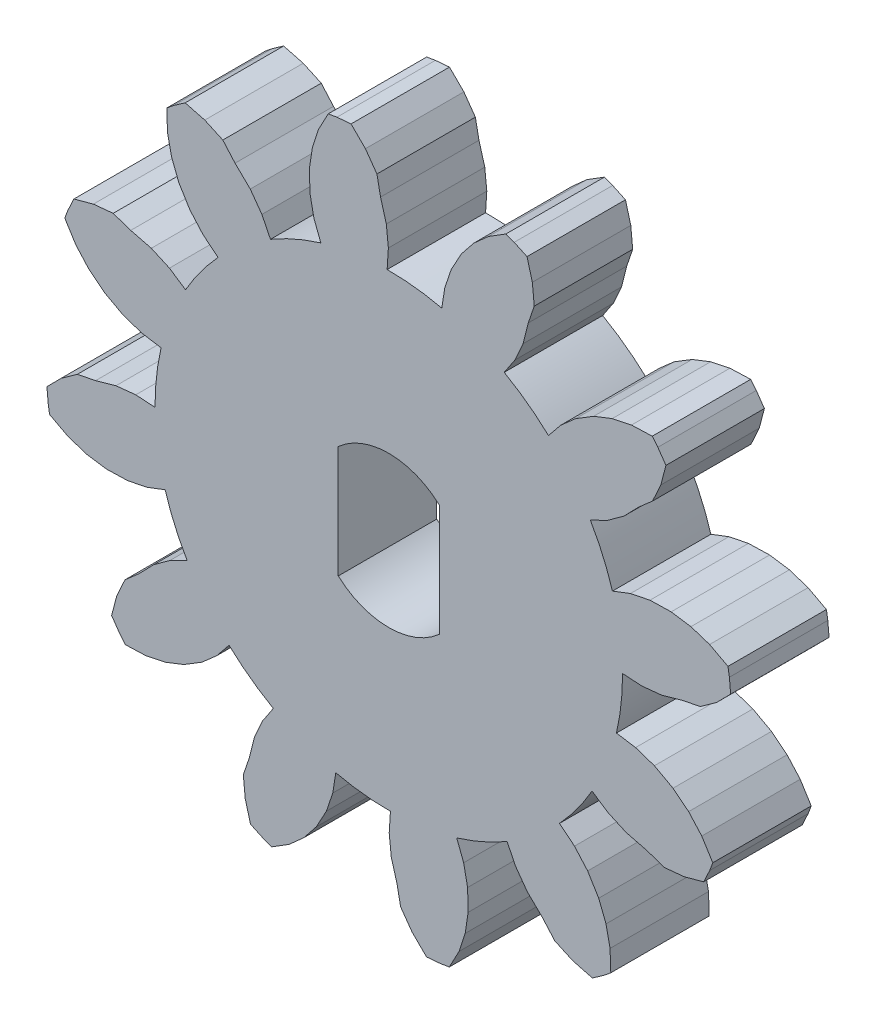
from build123d import *

# Parameters (mm, degrees)
BOSS_EXTRUDE1_DEPTH = 3


with BuildPart() as part:
    # Sketch2 → Boss-Extrude1 (new body)
    with BuildSketch(Plane.XY):
        with BuildLine():
            Line((10.764312003, 2.768963832), (11.314585021, 2.979826852))
            Line((11.314585021, 2.979826852), (11.907905886, 3.099989043))
            Line((11.907905886, 3.099989043), (12.554062339, 3.116630782))
            Line((12.554062339, 3.116630782), (13.15582989, 3.026446478))
            Line((13.15582989, 3.026446478), (13.724935617, 2.839967225))
            Line((13.724935617, 2.839967225), (14.284624243, 2.542841558))
            Line((14.284624243, 2.542841558), (14.328442059, 2.277753344))
            Line((14.328442059, 2.277753344), (14.365462724, 1.848073128))
            Line((14.365462724, 1.848073128), (13.931453723, 1.409980148))
            Line((13.931453723, 1.409980148), (13.438784278, 1.05923704))
            Line((13.438784278, 1.05923704), (12.883922864, 0.949031011))
            Line((12.883922864, 0.949031011), (12.262066151, 0.772709319))
            Line((12.262066151, 0.772709319), (11.659859376, 0.710938766))
            Line((11.659859376, 0.710938766), (11.07177128, 0.748568517))
            ThreePointArc((11.07177128, 0.748568517), (11.028281112, -0.089512253), (10.88653804, -0.916663796))
            Line((10.88653804, -0.916663796), (11.468519963, -1.009187572))
            Line((11.468519963, -1.009187572), (12.042432, -1.201784495))
            Line((12.042432, -1.201784495), (12.610340773, -1.510450553))
            Line((12.610340773, -1.510450553), (13.086394607, -1.889436226))
            Line((13.086394607, -1.889436226), (13.486014998, -2.33548486))
            Line((13.486014998, -2.33548486), (13.822156732, -2.872647549))
            Line((13.822156732, -2.872647549), (13.727559967, -3.124129585))
            Line((13.727559967, -3.124129585), (13.544780695, -3.5147539))
            Line((13.544780695, -3.5147539), (12.949871384, -3.677149049))
            Line((12.949871384, -3.677149049), (12.347835576, -3.734566768))
            Line((12.347835576, -3.734566768), (11.812208481, -3.552577282))
            Line((11.812208481, -3.552577282), (11.185503925, -3.39434799))
            Line((11.185503925, -3.39434799), (10.633092282, -3.146739471))
            Line((10.633092282, -3.146739471), (10.142607927, -2.820107103))
            ThreePointArc((10.142607927, -2.820107103), (9.685903952, -3.524161256), (9.14957508, -4.169623969))
            Line((9.14957508, -4.169623969), (9.607324321, -4.54074287))
            Line((9.607324321, -4.54074287), (10.008048263, -4.994492717))
            Line((10.008048263, -4.994492717), (10.345538658, -5.545759751))
            Line((10.345538658, -5.545759751), (10.568320536, -6.111997889))
            Line((10.568320536, -6.111997889), (10.691377629, -6.698097533))
            Line((10.691377629, -6.698097533), (10.713903566, -7.331364934))
            Line((10.713903566, -7.331364934), (10.506239347, -7.501856383))
            Line((10.506239347, -7.501856383), (10.152635696, -7.748757328))
            Line((10.152635696, -7.748757328), (9.556231545, -7.591940997))
            Line((9.556231545, -7.591940997), (9.006144382, -7.340648296))
            Line((9.006144382, -7.340648296), (8.633272454, -6.915227231))
            Line((8.633272454, -6.915227231), (8.169645033, -6.464844366))
            Line((8.169645033, -6.464844366), (7.815046777, -5.974203277))
            Line((7.815046777, -5.974203277), (7.55359105, -5.446089171))
            ThreePointArc((7.55359105, -5.446089171), (6.806046728, -5.827465966), (6.018840944, -6.118288636))
            Line((6.018840944, -6.118288636), (6.229703964, -6.668561653))
            Line((6.229703964, -6.668561653), (6.349866155, -7.261882518))
            Line((6.349866155, -7.261882518), (6.366507894, -7.908038972))
            Line((6.366507894, -7.908038972), (6.27632359, -8.509806523))
            Line((6.27632359, -8.509806523), (6.089844337, -9.07891225))
            Line((6.089844337, -9.07891225), (5.79271867, -9.638600875))
            Line((5.79271867, -9.638600875), (5.527630456, -9.682418692))
            Line((5.527630456, -9.682418692), (5.09795024, -9.719439356))
            Line((5.09795024, -9.719439356), (4.65985726, -9.285430355))
            Line((4.65985726, -9.285430355), (4.309114152, -8.792760911))
            Line((4.309114152, -8.792760911), (4.198908123, -8.237899496))
            Line((4.198908123, -8.237899496), (4.022586431, -7.616042784))
            Line((4.022586431, -7.616042784), (3.960815877, -7.013836008))
            Line((3.960815877, -7.013836008), (3.998445629, -6.425747912))
            ThreePointArc((3.998445629, -6.425747912), (3.160364858, -6.382257745), (2.333213316, -6.240514673))
            Line((2.333213316, -6.240514673), (2.24068954, -6.822496595))
            Line((2.24068954, -6.822496595), (2.048092617, -7.396408632))
            Line((2.048092617, -7.396408632), (1.739426559, -7.964317405))
            Line((1.739426559, -7.964317405), (1.360440885, -8.44037124))
            Line((1.360440885, -8.44037124), (0.914392252, -8.83999163))
            Line((0.914392252, -8.83999163), (0.377229563, -9.176133364))
            Line((0.377229563, -9.176133364), (0.125747527, -9.0815366))
            Line((0.125747527, -9.0815366), (-0.264876788, -8.898757328))
            Line((-0.264876788, -8.898757328), (-0.427271937, -8.303848017))
            Line((-0.427271937, -8.303848017), (-0.484689656, -7.701812209))
            Line((-0.484689656, -7.701812209), (-0.30270017, -7.166185114))
            Line((-0.30270017, -7.166185114), (-0.144470879, -6.539480557))
            Line((-0.144470879, -6.539480557), (0.103137641, -5.987068915))
            Line((0.103137641, -5.987068915), (0.429770009, -5.49658456))
            ThreePointArc((0.429770009, -5.49658456), (-0.274284144, -5.039880584), (-0.919746857, -4.503551712))
            Line((-0.919746857, -4.503551712), (-1.290865759, -4.961300953))
            Line((-1.290865759, -4.961300953), (-1.744615605, -5.362024896))
            Line((-1.744615605, -5.362024896), (-2.295882639, -5.699515291))
            Line((-2.295882639, -5.699515291), (-2.862120777, -5.922297168))
            Line((-2.862120777, -5.922297168), (-3.448220421, -6.045354261))
            Line((-3.448220421, -6.045354261), (-4.081487822, -6.067880198))
            Line((-4.081487822, -6.067880198), (-4.251979272, -5.860215979))
            Line((-4.251979272, -5.860215979), (-4.498880216, -5.506612328))
            Line((-4.498880216, -5.506612328), (-4.342063885, -4.910208178))
            Line((-4.342063885, -4.910208178), (-4.090771184, -4.360121014))
            Line((-4.090771184, -4.360121014), (-3.665350119, -3.987249086))
            Line((-3.665350119, -3.987249086), (-3.214967254, -3.523621665))
            Line((-3.214967254, -3.523621665), (-2.724326165, -3.169023409))
            Line((-2.724326165, -3.169023409), (-2.196212059, -2.907567682))
            ThreePointArc((-2.196212059, -2.907567682), (-2.577588854, -2.160023361), (-2.868411524, -1.372817576))
            Line((-2.868411524, -1.372817576), (-3.418684541, -1.583680597))
            Line((-3.418684541, -1.583680597), (-4.012005406, -1.703842787))
            Line((-4.012005406, -1.703842787), (-4.65816186, -1.720484526))
            Line((-4.65816186, -1.720484526), (-5.259929411, -1.630300222))
            Line((-5.259929411, -1.630300222), (-5.829035138, -1.44382097))
            Line((-5.829035138, -1.44382097), (-6.388723763, -1.146695302))
            Line((-6.388723763, -1.146695302), (-6.43254158, -0.881607088))
            Line((-6.43254158, -0.881607088), (-6.469562245, -0.451926872))
            Line((-6.469562245, -0.451926872), (-6.035553243, -0.013833892))
            Line((-6.035553243, -0.013833892), (-5.542883799, 0.336909216))
            Line((-5.542883799, 0.336909216), (-4.988022384, 0.447115245))
            Line((-4.988022384, 0.447115245), (-4.366165672, 0.623436937))
            Line((-4.366165672, 0.623436937), (-3.763958897, 0.68520749))
            Line((-3.763958897, 0.68520749), (-3.175870801, 0.647577739))
            ThreePointArc((-3.175870801, 0.647577739), (-3.132380633, 1.485658509), (-2.990637561, 2.312810051))
            Line((-2.990637561, 2.312810051), (-3.572619483, 2.405333828))
            Line((-3.572619483, 2.405333828), (-4.146531521, 2.597930751))
            Line((-4.146531521, 2.597930751), (-4.714440293, 2.906596809))
            Line((-4.714440293, 2.906596809), (-5.190494128, 3.285582482))
            Line((-5.190494128, 3.285582482), (-5.590114518, 3.731631116))
            Line((-5.590114518, 3.731631116), (-5.926256252, 4.268793805))
            Line((-5.926256252, 4.268793805), (-5.831659488, 4.52027584))
            Line((-5.831659488, 4.52027584), (-5.648880216, 4.910900156))
            Line((-5.648880216, 4.910900156), (-5.053970905, 5.073295305))
            Line((-5.053970905, 5.073295305), (-4.451935097, 5.130713024))
            Line((-4.451935097, 5.130713024), (-3.916308002, 4.948723538))
            Line((-3.916308002, 4.948723538), (-3.289603445, 4.790494246))
            Line((-3.289603445, 4.790494246), (-2.737191803, 4.542885727))
            Line((-2.737191803, 4.542885727), (-2.246707448, 4.216253359))
            ThreePointArc((-2.246707448, 4.216253359), (-1.790003473, 4.920307512), (-1.2536746, 5.565770224))
            Line((-1.2536746, 5.565770224), (-1.711423841, 5.936889126))
            Line((-1.711423841, 5.936889126), (-2.112147784, 6.390638973))
            Line((-2.112147784, 6.390638973), (-2.449638179, 6.941906007))
            Line((-2.449638179, 6.941906007), (-2.672420056, 7.508144145))
            Line((-2.672420056, 7.508144145), (-2.79547715, 8.094243789))
            Line((-2.79547715, 8.094243789), (-2.818003086, 8.72751119))
            Line((-2.818003086, 8.72751119), (-2.610338867, 8.898002639))
            Line((-2.610338867, 8.898002639), (-2.256735217, 9.144903584))
            Line((-2.256735217, 9.144903584), (-1.660331066, 8.988087253))
            Line((-1.660331066, 8.988087253), (-1.110243903, 8.736794552))
            Line((-1.110243903, 8.736794552), (-0.737371974, 8.311373486))
            Line((-0.737371974, 8.311373486), (-0.273744554, 7.860990622))
            Line((-0.273744554, 7.860990622), (0.080853702, 7.370349533))
            Line((0.080853702, 7.370349533), (0.34230943, 6.842235426))
            ThreePointArc((0.34230943, 6.842235426), (1.089853751, 7.223612222), (1.877059536, 7.514434891))
            Line((1.877059536, 7.514434891), (1.666196515, 8.064707909))
            Line((1.666196515, 8.064707909), (1.546034324, 8.658028774))
            Line((1.546034324, 8.658028774), (1.529392586, 9.304185228))
            Line((1.529392586, 9.304185228), (1.619576889, 9.905952778))
            Line((1.619576889, 9.905952778), (1.806056142, 10.475058505))
            Line((1.806056142, 10.475058505), (2.10318181, 11.034747131))
            Line((2.10318181, 11.034747131), (2.368270023, 11.078564947))
            Line((2.368270023, 11.078564947), (2.79795024, 11.115585612))
            Line((2.79795024, 11.115585612), (3.23604322, 10.681576611))
            Line((3.23604322, 10.681576611), (3.586786327, 10.188907166))
            Line((3.586786327, 10.188907166), (3.696992357, 9.634045752))
            Line((3.696992357, 9.634045752), (3.873314049, 9.01218904))
            Line((3.873314049, 9.01218904), (3.935084602, 8.409982264))
            Line((3.935084602, 8.409982264), (3.897454851, 7.821894168))
            ThreePointArc((3.897454851, 7.821894168), (4.735535621, 7.778404001), (5.562687163, 7.636660929))
            Line((5.562687163, 7.636660929), (5.65521094, 8.218642851))
            Line((5.65521094, 8.218642851), (5.847807863, 8.792554888))
            Line((5.847807863, 8.792554888), (6.156473921, 9.360463661))
            Line((6.156473921, 9.360463661), (6.535459594, 9.836517495))
            Line((6.535459594, 9.836517495), (6.981508228, 10.236137886))
            Line((6.981508228, 10.236137886), (7.518670917, 10.57227962))
            Line((7.518670917, 10.57227962), (7.770152952, 10.477682856))
            Line((7.770152952, 10.477682856), (8.160777268, 10.294903584))
            Line((8.160777268, 10.294903584), (8.323172417, 9.699994273))
            Line((8.323172417, 9.699994273), (8.380590136, 9.097958465))
            Line((8.380590136, 9.097958465), (8.19860065, 8.562331369))
            Line((8.19860065, 8.562331369), (8.040371358, 7.935626813))
            Line((8.040371358, 7.935626813), (7.792762839, 7.383215171))
            Line((7.792762839, 7.383215171), (7.46613047, 6.892730815))
            ThreePointArc((7.46613047, 6.892730815), (8.170184624, 6.43602684), (8.815647336, 5.899697968))
            Line((8.815647336, 5.899697968), (9.186766238, 6.357447209))
            Line((9.186766238, 6.357447209), (9.640516085, 6.758171151))
            Line((9.640516085, 6.758171151), (10.191783119, 7.095661547))
            Line((10.191783119, 7.095661547), (10.758021257, 7.318443424))
            Line((10.758021257, 7.318443424), (11.3441209, 7.441500517))
            Line((11.3441209, 7.441500517), (11.977388302, 7.464026454))
            Line((11.977388302, 7.464026454), (12.147879751, 7.256362235))
            Line((12.147879751, 7.256362235), (12.394780695, 6.902758584))
            Line((12.394780695, 6.902758584), (12.237964365, 6.306354434))
            Line((12.237964365, 6.306354434), (11.986671664, 5.75626727))
            Line((11.986671664, 5.75626727), (11.561250598, 5.383395342))
            Line((11.561250598, 5.383395342), (11.110867734, 4.919767921))
            Line((11.110867734, 4.919767921), (10.620226645, 4.565169665))
            Line((10.620226645, 4.565169665), (10.092112538, 4.303713938))
            ThreePointArc((10.092112538, 4.303713938), (10.473489333, 3.556169616), (10.764312003, 2.768963832))
        make_face()
        with BuildLine():
            Line((2.40795024, -1.010259392), (2.40795024, 2.406405648))
            ThreePointArc((2.40795024, 2.406405648), (3.94795024, 2.998073128), (5.48795024, 2.406405648))
            Line((5.48795024, 2.406405648), (5.48795024, -1.010259392))
            ThreePointArc((5.48795024, -1.010259392), (3.94795024, -1.601926872), (2.40795024, -1.010259392))
        make_face(mode=Mode.SUBTRACT)
    extrude(amount=BOSS_EXTRUDE1_DEPTH)


solid = part.part
